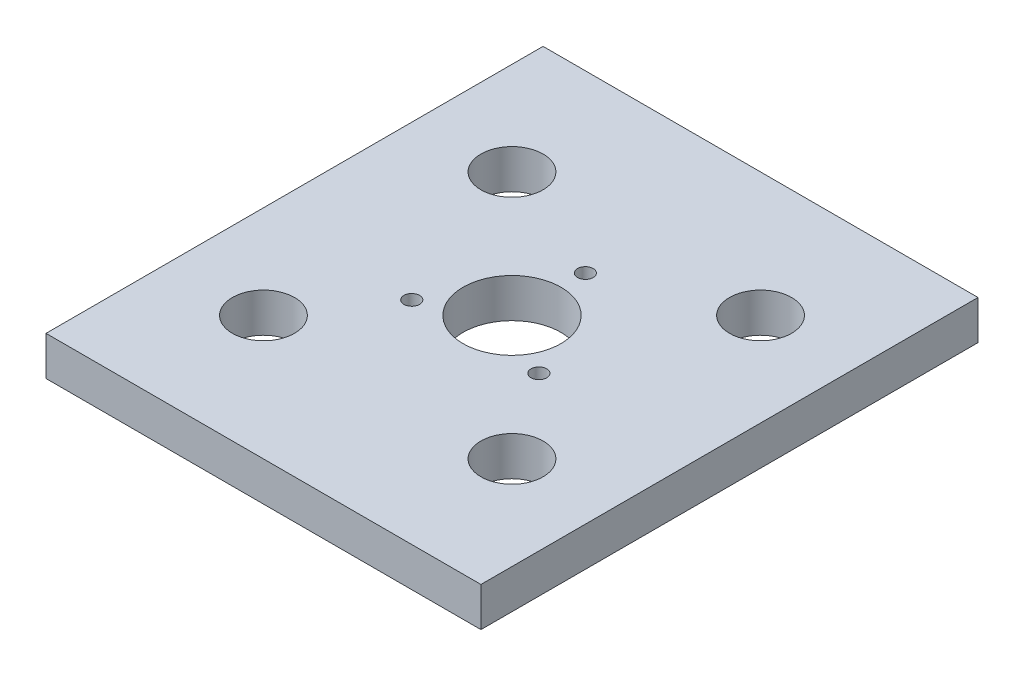
from build123d import *

# Parameters (mm, degrees)
SKETCH1_R           = 3.175
SKETCH1_R_2         = 0.8
SKETCH1_R_3         = 5
BOSS_EXTRUDE1_DEPTH = 4
SKETCH2_R           = 1.6
CUT_EXTRUDE2_DEPTH  = 2


with BuildPart() as part:
    # Sketch1 → Boss-Extrude1 (new body)
    with BuildSketch(Plane(origin=(0, 0, 0), x_dir=(1, 0, 0), z_dir=(0, 1, 0))):
        Polygon((-22.225, -25.4), (-12.829728408, -25.4), (0, -25.4), (12.829728408, -25.4), (22.225, -25.4), (22.225, 25.4), (-22.225, 25.4), align=None)
        with Locations((-12.7, -12.7)):
            Circle(SKETCH1_R, mode=Mode.SUBTRACT)
        with Locations((-6.495190528, -3.75)):
            Circle(SKETCH1_R_2, mode=Mode.SUBTRACT)
        Circle(SKETCH1_R_3, mode=Mode.SUBTRACT)
        with Locations((6.495190528, -3.75)):
            Circle(SKETCH1_R_2, mode=Mode.SUBTRACT)
        with Locations((12.7, -12.7)):
            Circle(SKETCH1_R, mode=Mode.SUBTRACT)
        with Locations((-12.7, 12.7)):
            Circle(SKETCH1_R, mode=Mode.SUBTRACT)
        with Locations((0, 7.5)):
            Circle(SKETCH1_R_2, mode=Mode.SUBTRACT)
        with Locations((12.7, 12.7)):
            Circle(SKETCH1_R, mode=Mode.SUBTRACT)
    extrude(amount=BOSS_EXTRUDE1_DEPTH)

    # Sketch2 → Cut-Extrude2 (cut)
    with BuildSketch(Plane(origin=(0, 0, 0), x_dir=(1, 0, 0), z_dir=(0, 1, 0))):
        with Locations((6.495190528, -3.75)):
            Circle(SKETCH2_R)
        with Locations((-6.495190528, -3.75)):
            Circle(SKETCH2_R)
        with Locations((0, 7.5)):
            Circle(SKETCH2_R)
    extrude(amount=CUT_EXTRUDE2_DEPTH, mode=Mode.SUBTRACT)


solid = part.part
